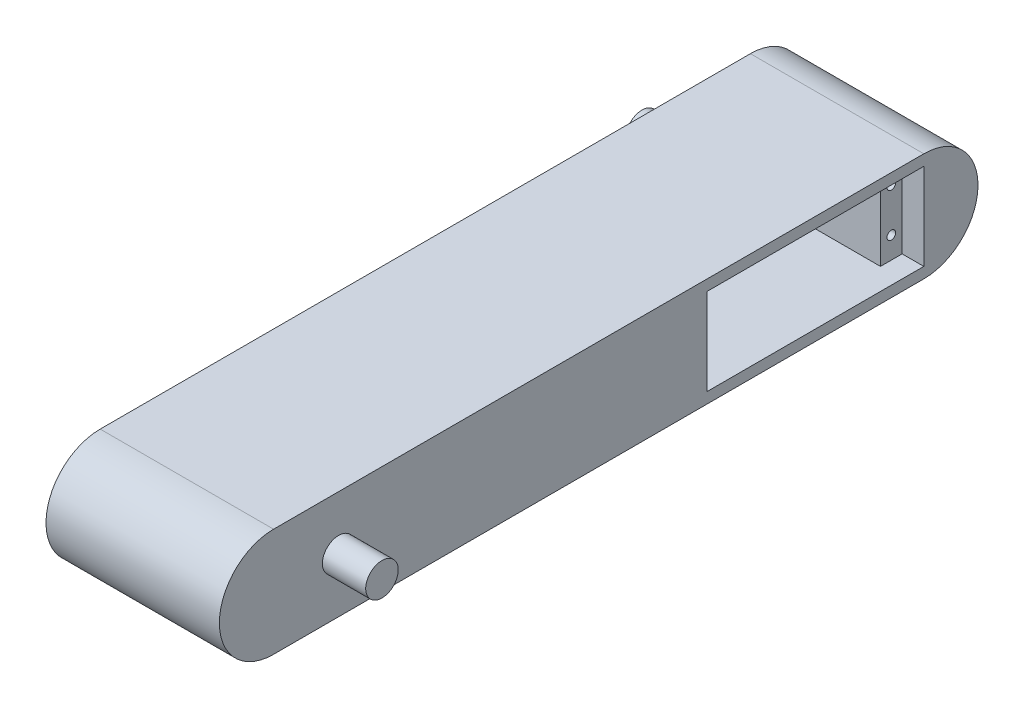
from build123d import *

# Parameters (mm, degrees)
BOSS_EXTRUDE1_DEPTH            = 20
F_2_0MM_DOWEL_HOLE1_AT_2_COUNT = 2
F_2_0MM_DOWEL_HOLE1_AT_2_PITCH = 10
SKETCH8_R                      = 3.75
BOSS_EXTRUDE2_DEPTH            = 10
SKETCH9_W                      = 35
SKETCH9_H                      = 50
BOSS_EXTRUDE3_DEPTH            = 2.5
SKETCH10_W                     = 35
SKETCH10_H                     = 50
BOSS_EXTRUDE4_DEPTH            = 2.5
SKETCH11_W                     = 35
SKETCH11_H                     = 25
BOSS_EXTRUDE5_DEPTH            = 100
BOSS_EXTRUDE6_DEPTH            = 5
BOSS_EXTRUDE9_DEPTH            = 40
BOSS_EXTRUDE10_DEPTH           = 40
SKETCH24_W                     = 50
SKETCH24_H                     = 20
CUT_EXTRUDE4_DEPTH             = 5
SKETCH26_W                     = 40
SKETCH26_H                     = 20
CUT_EXTRUDE5_DEPTH             = 35
F_2_0MM_DOWEL_HOLE2_D          = 2
F_2_0MM_DOWEL_HOLE2_DEPTH      = 10
F_2_0MM_DOWEL_HOLE2_TIP        = 0.600860619
SKETCH30_R                     = 3.75
BOSS_EXTRUDE11_DEPTH           = 10


with BuildPart() as part:
    # Sketch1 → Boss-Extrude1 (new body)
    with BuildSketch(Plane(origin=(0, 0, 0), x_dir=(1, 0, 0), z_dir=(0, 1, 0))):
        Polygon((-12.5, 25), (-12.5, 20), (17.5, 20), (17.5, -20), (-12.5, -20), (-12.5, -25), (22.5, -25), (22.5, 25), align=None)
    extrude(amount=BOSS_EXTRUDE1_DEPTH)

    # Sketch7 → Ø2.0mm Dowel Hole1 (revolve, cut)
    with BuildSketch(Plane(origin=(-12.5, 15, -22.5), x_dir=(0, 0, 1), z_dir=(0, 1, 0))):
        Polygon((0, 0), (0, 10.600860619), (1, 10), (1, 0), align=None)
    f_2_0mm_dowel_hole1 = revolve(axis=Axis((-18.85, 15, -22.5), (1, 0, 0)), mode=Mode.SUBTRACT)

    # Ø2.0mm Dowel Hole1 at 2: Ø2.0mm Dowel Hole1 ×2
    with Locations(*[(0, -i * F_2_0MM_DOWEL_HOLE1_AT_2_PITCH, 0) for i in range(1, F_2_0MM_DOWEL_HOLE1_AT_2_COUNT)]):
        add(f_2_0mm_dowel_hole1, mode=Mode.SUBTRACT)

    # Mirror1: Ø2.0mm Dowel Hole1 across plane
    add(f_2_0mm_dowel_hole1.mirror(Plane.XY), mode=Mode.SUBTRACT)

    # Mirror1 copy 1 sketch → Mirror1 copy 1 (revolve, cut)
    with BuildSketch(Plane(origin=(-12.5, 5, 22.5), x_dir=(0, 0, -1), z_dir=(0, 1, 0))):
        Polygon((0, 0), (0, -10.600860619), (1, -10), (1, 0), align=None)
    revolve(axis=Axis((-18.85, 5, 22.5), (-1, 0, 0)), mode=Mode.SUBTRACT)

    # Sketch8 → Boss-Extrude2 (add)
    with BuildSketch(Plane(origin=(22.5, 0, 0), x_dir=(0, 0, -1), z_dir=(1, 0, 0))):
        with Locations((-10, 10)):
            Circle(SKETCH8_R)
    extrude(amount=BOSS_EXTRUDE2_DEPTH)

    # Sketch9 → Boss-Extrude3 (add)
    with BuildSketch(Plane(origin=(0, 20, 0), x_dir=(1, 0, 0), z_dir=(0, 1, 0))):
        with Locations((5, 0)):
            Rectangle(SKETCH9_W, SKETCH9_H)
    extrude(amount=BOSS_EXTRUDE3_DEPTH)

    # Sketch10 → Boss-Extrude4 (add)
    with BuildSketch(Plane.XZ):
        with Locations((5, 0)):
            Rectangle(SKETCH10_W, SKETCH10_H)
    extrude(amount=BOSS_EXTRUDE4_DEPTH)

    # Sketch11 → Boss-Extrude5 (add)
    with BuildSketch(Plane(origin=(0, 0, -25), x_dir=(-1, 0, 0), z_dir=(0, 0, -1))):
        with Locations((-5, 10)):
            Rectangle(SKETCH11_W, SKETCH11_H)
    extrude(amount=BOSS_EXTRUDE5_DEPTH)

    # Sketch12 → Boss-Extrude6 (add)
    with BuildSketch(Plane.ZY.offset(12.5)):
        Polygon((25, 22.5), (-125, 22.5), (-125, -2.5), (25, -2.5), (25, 0), (20, 0), (-20, 0), (-25, 0), (-25, 20), (-20, 20), (20, 20), (25, 20), align=None)
    extrude(amount=BOSS_EXTRUDE6_DEPTH)

    # Sketch20 → Boss-Extrude9 (add)
    with BuildSketch(Plane(origin=(22.5, 0, 0), x_dir=(0, 0, -1), z_dir=(1, 0, 0))):
        with BuildLine():
            ThreePointArc((125, -2.5), (137.5, 10), (125, 22.5))
            Line((125, 22.5), (125, -2.5))
        make_face()
    extrude(amount=-BOSS_EXTRUDE9_DEPTH)

    # Sketch23 → Boss-Extrude10 (add)
    with BuildSketch(Plane(origin=(22.5, 0, 0), x_dir=(0, 0, -1), z_dir=(1, 0, 0))):
        with BuildLine():
            Line((-25, -2.5), (-25, 22.5))
            ThreePointArc((-25, 22.5), (-37.5, 10), (-25, -2.5))
        make_face()
    extrude(amount=-BOSS_EXTRUDE10_DEPTH)

    # Sketch24 → Cut-Extrude4 (cut)
    with BuildSketch(Plane(origin=(22.5, 0, 0), x_dir=(0, 0, -1), z_dir=(1, 0, 0))):
        with Locations((100, 10)):
            Rectangle(SKETCH24_W, SKETCH24_H)
    extrude(amount=-CUT_EXTRUDE4_DEPTH, mode=Mode.SUBTRACT)

    # Sketch26 → Cut-Extrude5 (cut)
    with BuildSketch(Plane(origin=(22.5, 0, 0), x_dir=(0, 0, -1), z_dir=(1, 0, 0))):
        with Locations((100, 10)):
            Rectangle(SKETCH26_W, SKETCH26_H)
    extrude(amount=-CUT_EXTRUDE5_DEPTH, mode=Mode.SUBTRACT)

    # Ø2.0mm Dowel Hole2
    with Locations(Plane(origin=(17.5, 0, 0), x_dir=(0, 0, -1), z_dir=(1, 0, 0))):
        with Locations((77.5, 15), (77.5, 5), (122.5, 15), (122.5, 5)):
            Hole(F_2_0MM_DOWEL_HOLE2_D / 2, depth=F_2_0MM_DOWEL_HOLE2_DEPTH)
            with Locations((0, 0, -(F_2_0MM_DOWEL_HOLE2_DEPTH + F_2_0MM_DOWEL_HOLE2_TIP / 2))):  # 118° drill point
                Cone(0, F_2_0MM_DOWEL_HOLE2_D / 2, F_2_0MM_DOWEL_HOLE2_TIP, mode=Mode.SUBTRACT)

    # Sketch30 → Boss-Extrude11 (add)
    with BuildSketch(Plane.ZY.offset(17.5)):
        with Locations((-110, 10)):
            Circle(SKETCH30_R)
    extrude(amount=BOSS_EXTRUDE11_DEPTH)


solid = part.part
